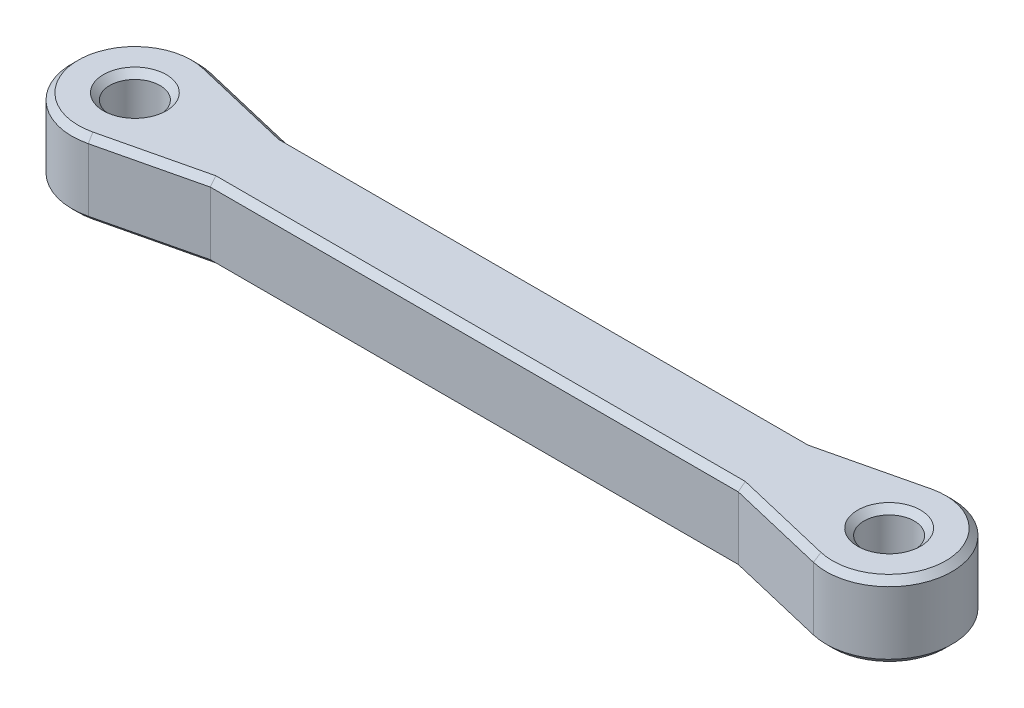
from build123d import *

# Parameters (mm, degrees)
EXTRUDE_1_DEPTH     = 3
SKETCH_2_R          = 1
CUT_EXTRUDE_1_DEPTH = 3
EXTRUDE_2_DEPTH     = 3
CHAMFER_1_SIZE      = 0.25


with BuildPart() as part:
    # 草图1 → 凸台-拉伸1 (new body)
    with BuildSketch(Plane(origin=(0, 0, 0), x_dir=(1, 0, 0), z_dir=(0, 1, 0))):
        with BuildLine():
            Line((2, 1.5), (28, 1.5))
            ThreePointArc((28, 1.5), (32.5, 0), (28, -1.5))
            Line((28, -1.5), (2, -1.5))
            ThreePointArc((2, -1.5), (-2.5, 0), (2, 1.5))
        make_face()
    extrude(amount=EXTRUDE_1_DEPTH)

    # 草图2 → 切除-拉伸1 (cut)
    with BuildSketch(Plane(origin=(0, 0, 0), x_dir=(1, 0, 0), z_dir=(0, 1, 0))):
        with Locations(Location((0, 0, 0), (0, 0, 270))):
            Circle(SKETCH_2_R)
        with Locations(Location((30, 0, 0), (0, 0, 270))):
            Circle(SKETCH_2_R)
    extrude(amount=CUT_EXTRUDE_1_DEPTH, mode=Mode.SUBTRACT)

    # 草图3 → 凸台-拉伸2 (add)
    with BuildSketch(Plane(origin=(0, 0, 0), x_dir=(1, 0, 0), z_dir=(0, 1, 0))):
        with BuildLine():
            Line((4.5, 1.5), (0.578145188, 2.432231104))
            ThreePointArc((0.578145188, 2.432231104), (1.370755945, 2.090700395), (2, 1.5))
            Line((2, 1.5), (4.5, 1.5))
        make_face()
        with BuildLine():
            Line((4.5, -1.5), (0.578145188, -2.432231104))
            ThreePointArc((0.578145188, -2.432231104), (1.370755945, -2.090700395), (2, -1.5))
            Line((2, -1.5), (4.5, -1.5))
        make_face()
        with BuildLine():
            Line((28, 1.5), (25.5, 1.5))
            Line((25.5, 1.5), (29.421854812, 2.432231104))
            ThreePointArc((29.421854812, 2.432231104), (28.629244055, 2.090700395), (28, 1.5))
        make_face()
        with BuildLine():
            Line((25.5, -1.5), (29.421854812, -2.432231104))
            ThreePointArc((29.421854812, -2.432231104), (28.629244055, -2.090700395), (28, -1.5))
            Line((28, -1.5), (25.5, -1.5))
        make_face()
    extrude(amount=EXTRUDE_2_DEPTH)

    # 倒角1
    chamfer_1_edges = [part.edges().sort_by_distance(p)[0] for p in [
        (0, 0, -1),
        (0, 3, -1),
        (30, 0, -1),
        (30, 3, -1),
        (-2.5, 0, 0),
        (-2.5, 3, 0),
        (2.539072594, 0, -1.966115552),
        (2.539072594, 3, -1.966115552),
        (15, 0, 1.5),
        (15, 3, 1.5),
        (2.539072594, 0, 1.966115552),
        (2.539072594, 3, 1.966115552),
        (32.5, 0, 0),
        (32.5, 3, 0),
        (27.460927406, 0, 1.966115552),
        (27.460927406, 3, 1.966115552),
        (15, 0, -1.5),
        (15, 3, -1.5),
        (27.460927406, 0, -1.966115552),
        (27.460927406, 3, -1.966115552),
    ]]
    chamfer(chamfer_1_edges, length=CHAMFER_1_SIZE)


solid = part.part
